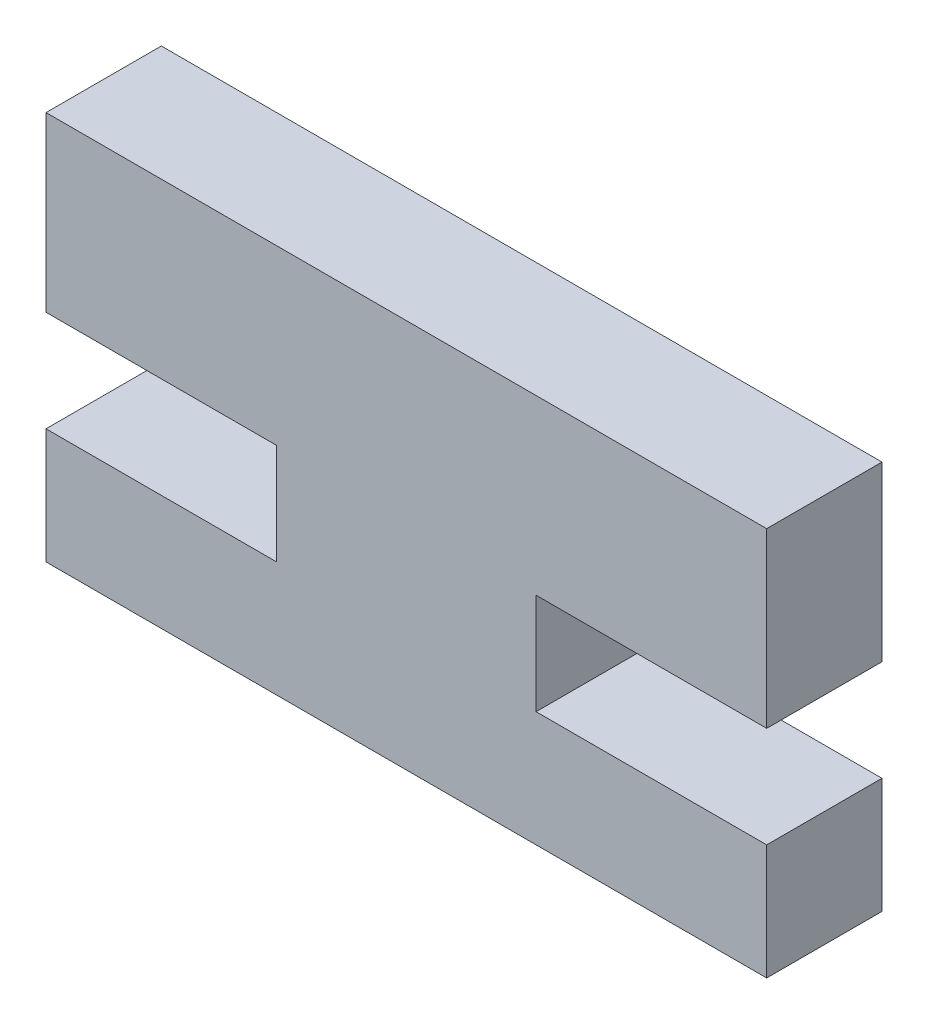
from build123d import *

# Parameters (mm, degrees)
BOSS_EXTRUDE1_DEPTH = 4


with BuildPart() as part:
    # Sketch1 → Boss-Extrude1 (new body)
    with BuildSketch(Plane.XY):
        Polygon((-68.171908981, 24.304447885), (-43.171908981, 24.304447885), (-43.171908981, 18.304447885), (-51.171908981, 18.304447885), (-51.171908981, 14.804447885), (-43.171908981, 14.804447885), (-43.171908981, 10.804447885), (-68.171908981, 10.804447885), (-68.171908981, 14.804447885), (-60.171908981, 14.804447885), (-60.171908981, 18.304447885), (-68.171908981, 18.304447885), align=None)
    extrude(amount=BOSS_EXTRUDE1_DEPTH)


solid = part.part
